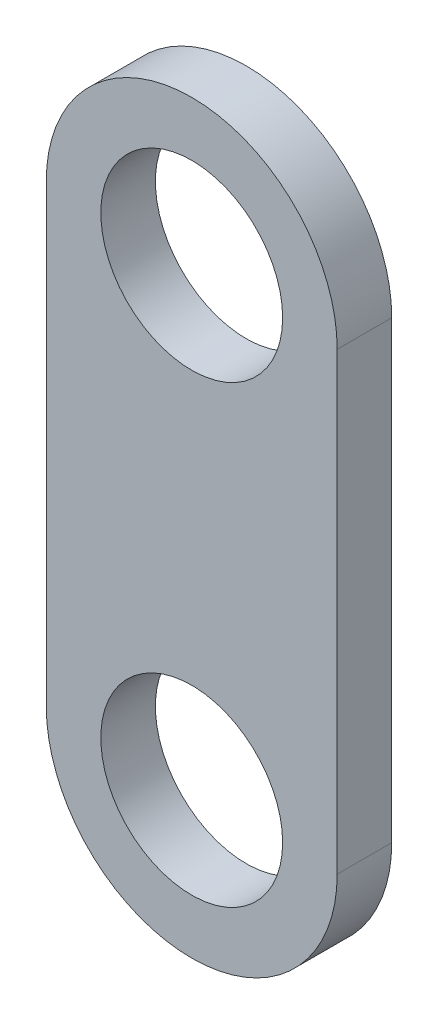
from build123d import *

# Parameters (mm, degrees)
SKETCH_1_R      = 0.5
EXTRUDE_1_DEPTH = 0.3


with BuildPart() as part:
    # 草圖1 → 填料-伸長1 (new body)
    with BuildSketch(Plane.XY):
        with BuildLine():
            Line((-0.8, -1.25), (-0.8, 1.25))
            ThreePointArc((-0.8, 1.25), (0, 2.05), (0.8, 1.25))
            Line((0.8, 1.25), (0.8, -1.25))
            ThreePointArc((0.8, -1.25), (0, -2.05), (-0.8, -1.25))
        make_face()
        with Locations((0, 1.25)):
            Circle(SKETCH_1_R, mode=Mode.SUBTRACT)
        with Locations((0, -1.25)):
            Circle(SKETCH_1_R, mode=Mode.SUBTRACT)
    extrude(amount=EXTRUDE_1_DEPTH)


solid = part.part
